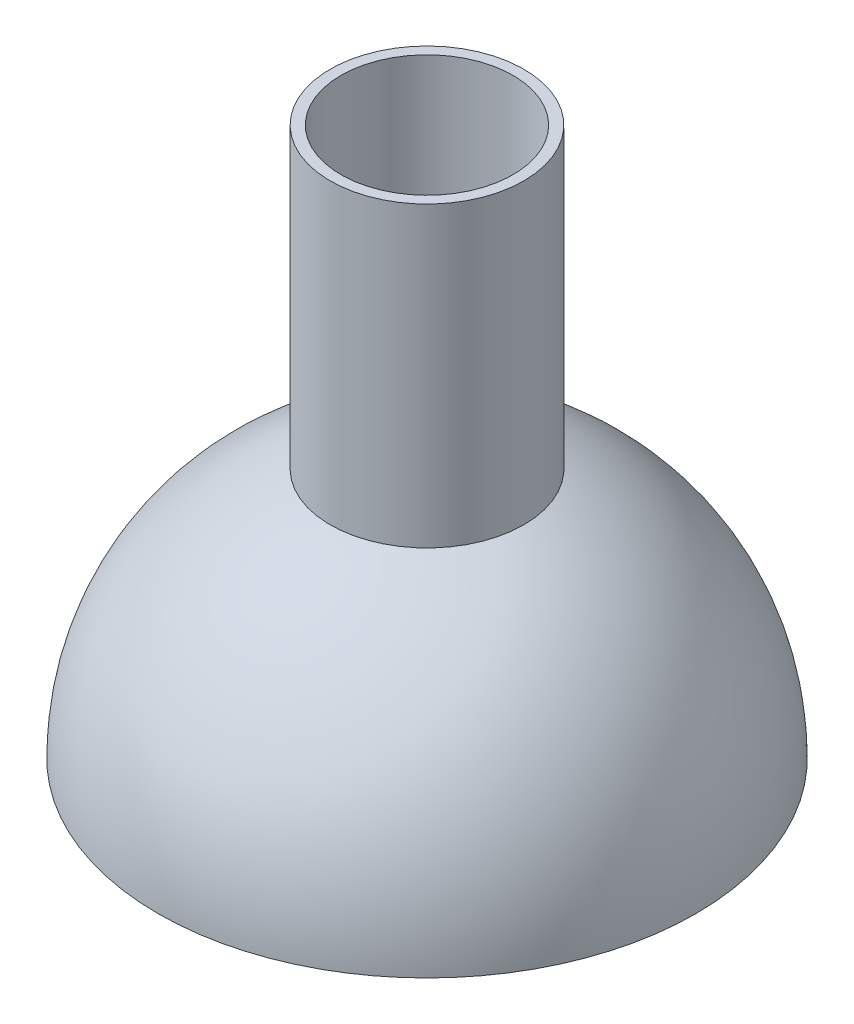
from build123d import *

# Parameters (mm, degrees)
REVOLVE1_ANGLE      = 180
CUT_REVOLVE1_ANGLE  = 180
BOSS_EXTRUDE1_START = -21
SKETCH6_R           = 9
BOSS_EXTRUDE1_DEPTH = 30
SKETCH7_R           = 8
CUT_EXTRUDE6_DEPTH  = 35


with BuildPart() as part:
    # Sketch1 → Revolve1 (revolve)
    with BuildSketch(Plane(origin=(0, 0, 0), x_dir=(1, 0, 0), z_dir=(0, 1, 0))):
        with BuildLine():
            Line((0, 25), (0, -25))
            ThreePointArc((0, -25), (25, 0), (0, 25))
        make_face()
    revolve(axis=Axis((0, 0, -25), (0, 0, 1)), revolution_arc=REVOLVE1_ANGLE)

    # Sketch2 → Cut-Revolve1 (revolve, cut)
    with BuildSketch(Plane.XZ):
        with BuildLine():
            Line((0, -20), (0, 20))
            ThreePointArc((0, 20), (20, 0), (0, -20))
        make_face()
    revolve(axis=Axis((0, 0, -20), (0, 0, 1)), revolution_arc=CUT_REVOLVE1_ANGLE, mode=Mode.SUBTRACT)


with BuildPart() as body_2:
    # Sketch6 → Boss-Extrude1 (new body)
    with BuildSketch(Plane(origin=(0, 0, 0), x_dir=(-1, 0, 0), z_dir=(0, -1, 0)).offset(BOSS_EXTRUDE1_START)):
        with Locations(Location((0, 0, 0), (0, 0, 180))):
            Circle(SKETCH6_R)
    extrude(amount=-BOSS_EXTRUDE1_DEPTH)


with BuildPart() as cut_extrude6_tool:
    # Sketch7 → Cut-Extrude6 (new body)
    with BuildSketch(Plane(origin=(0, 51, 0), x_dir=(-1, 0, 0), z_dir=(0, 1, 0))):
        Circle(SKETCH7_R)
    extrude(amount=-CUT_EXTRUDE6_DEPTH)


with BuildPart() as part_1:
    add(part.part)

    # Cut-Extrude6: cut by cut_extrude6_tool
    add(cut_extrude6_tool.part, mode=Mode.SUBTRACT)


with BuildPart() as body_2_1:
    add(body_2.part)

    # Cut-Extrude6: cut by cut_extrude6_tool
    add(cut_extrude6_tool.part, mode=Mode.SUBTRACT)


solid = Compound([part_1.part, body_2_1.part])
